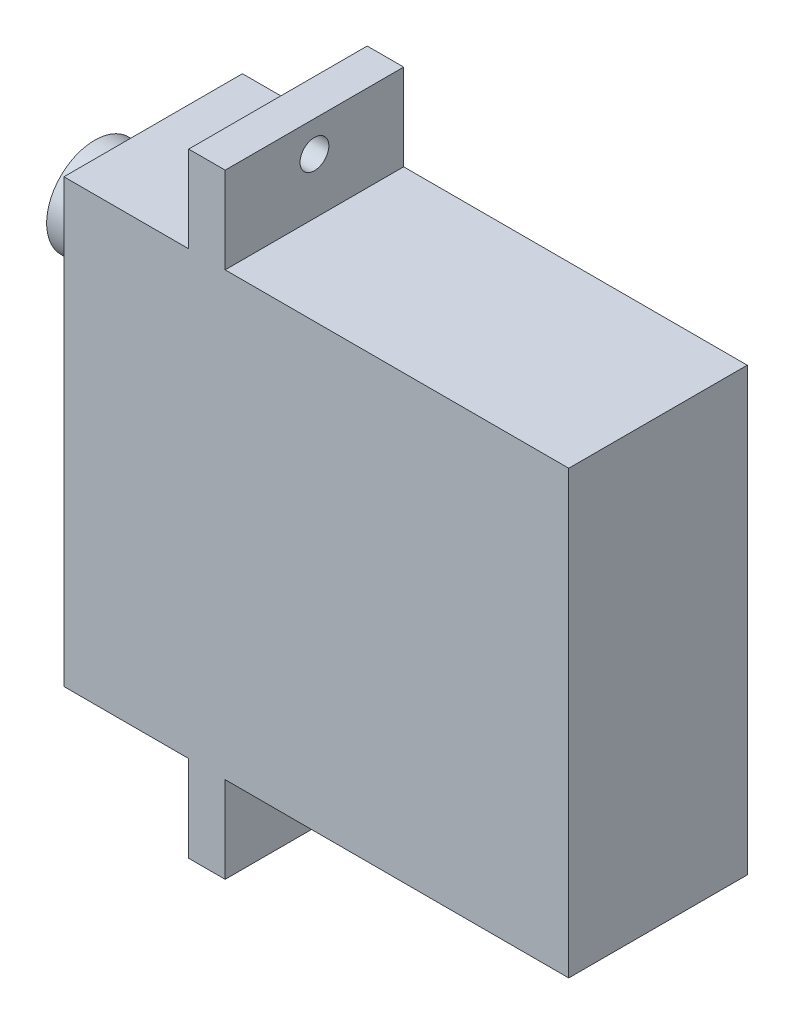
from build123d import *

# Parameters (mm, degrees)
BOSS_EXTRUDE1_DEPTH = 4.65
SKETCH3_W           = 3.05
SKETCH3_H           = 2.5
SKETCH4_R           = 0.75
CUT_EXTRUDE1_DEPTH  = 10


with BuildPart() as part:
    # Sketch1 → Boss-Extrude1 (new, symmetric)
    with BuildSketch(Plane.XY):
        Polygon((-4.75, 11.5), (-4.75, 16), (-6.65, 16), (-6.65, 11.5), (-13.15, 11.5), (-13.15, -11.5), (-6.65, -11.5), (-6.65, -16), (-4.75, -16), (-4.75, -11.5), (13.15, -11.5), (13.15, 11.5), align=None)
    extrude(amount=BOSS_EXTRUDE1_DEPTH, both=True)

    # Sketch3 → Revolve1 (revolve)
    with BuildSketch(Plane.XY, mode=Mode.PRIVATE) as revolve1_sk:
        with Locations((-14.675, 8.05)):
            Rectangle(SKETCH3_W, SKETCH3_H)
    revolve(revolve1_sk.sketch.rotate(Axis((-13.15, 6.8, 0), (-1, 0, 0)), 90), axis=Axis((-13.15, 6.8, 0), (-1, 0, 0)))

    # Sketch4 → Cut-Extrude1 (cut)
    with BuildSketch(Plane.ZY.offset(6.65)):
        with Locations(Location((0, 14.4, 0), (0, 0, 270))):
            Circle(SKETCH4_R)
        with Locations(Location((0, -14.4, 0), (0, 0, 270))):
            Circle(SKETCH4_R)
    extrude(amount=-CUT_EXTRUDE1_DEPTH, mode=Mode.SUBTRACT)


solid = part.part
